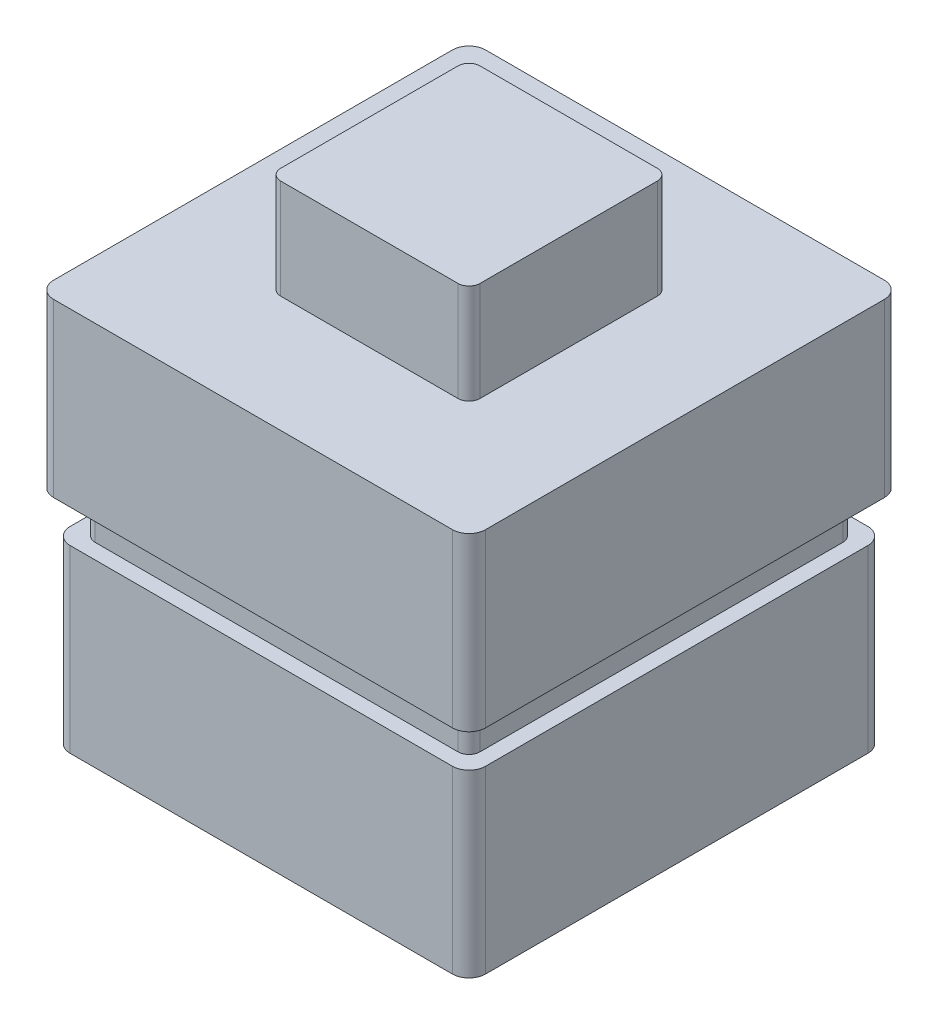
from build123d import *

# Parameters (mm, degrees)
UPPER_START = 67
UPPER_DEPTH = 6.2
NECK_START  = 65.5
NECK_DEPTH  = 1.7
BODY_START  = 59
BODY_DEPTH  = 6.5
STEM_START  = 73.2
STEM_DEPTH  = 3.6


with BuildPart() as part:
    # Sketch1 → Upper (new body)
    with BuildSketch(Plane(origin=(0, 0, 0), x_dir=(1, 0, 0), z_dir=(0, 1, 0)).offset(UPPER_START)):
        with BuildLine():
            Line((-7.2, 89.3), (7.2, 89.3))
            ThreePointArc((7.2, 89.3), (7.624264069, 89.124264069), (7.8, 88.7))
            Line((7.8, 88.7), (7.8, 74.3))
            ThreePointArc((7.8, 74.3), (7.624264069, 73.875735931), (7.2, 73.7))
            Line((7.2, 73.7), (-7.2, 73.7))
            ThreePointArc((-7.2, 73.7), (-7.624264069, 73.875735931), (-7.8, 74.3))
            Line((-7.8, 74.3), (-7.8, 88.7))
            ThreePointArc((-7.8, 88.7), (-7.624264069, 89.124264069), (-7.2, 89.3))
        make_face()
    extrude(amount=UPPER_DEPTH)

    # Sketch2 → Neck (add)
    with BuildSketch(Plane(origin=(0, 0, 0), x_dir=(1, 0, 0), z_dir=(0, 1, 0)).offset(NECK_START)):
        with BuildLine():
            Line((-6.55, 88.45), (6.55, 88.45))
            ThreePointArc((6.55, 88.45), (6.832842712, 88.332842712), (6.95, 88.05))
            Line((6.95, 88.05), (6.95, 74.95))
            ThreePointArc((6.95, 74.95), (6.832842712, 74.667157288), (6.55, 74.55))
            Line((6.55, 74.55), (-6.55, 74.55))
            ThreePointArc((-6.55, 74.55), (-6.832842712, 74.667157288), (-6.95, 74.95))
            Line((-6.95, 74.95), (-6.95, 88.05))
            ThreePointArc((-6.95, 88.05), (-6.832842712, 88.332842712), (-6.55, 88.45))
        make_face()
    extrude(amount=NECK_DEPTH)

    # Sketch3 → Body (add)
    with BuildSketch(Plane(origin=(0, 0, 0), x_dir=(1, 0, 0), z_dir=(0, 1, 0)).offset(BODY_START)):
        with BuildLine():
            Line((-6.9, 89), (6.9, 89))
            ThreePointArc((6.9, 89), (7.324264069, 88.824264069), (7.5, 88.4))
            Line((7.5, 88.4), (7.5, 74.6))
            ThreePointArc((7.5, 74.6), (7.324264069, 74.175735931), (6.9, 74))
            Line((6.9, 74), (-6.9, 74))
            ThreePointArc((-6.9, 74), (-7.324264069, 74.175735931), (-7.5, 74.6))
            Line((-7.5, 74.6), (-7.5, 88.4))
            ThreePointArc((-7.5, 88.4), (-7.324264069, 88.824264069), (-6.9, 89))
        make_face()
    extrude(amount=BODY_DEPTH)

    # Sketch4 → Stem (add)
    with BuildSketch(Plane(origin=(0, 0, 0), x_dir=(1, 0, 0), z_dir=(0, 1, 0)).offset(STEM_START)):
        with BuildLine():
            Line((-3.2, 85.1), (3.2, 85.1))
            ThreePointArc((3.2, 85.1), (3.482842712, 84.982842712), (3.6, 84.7))
            Line((3.6, 84.7), (3.6, 78.3))
            ThreePointArc((3.6, 78.3), (3.482842712, 78.017157288), (3.2, 77.9))
            Line((3.2, 77.9), (-3.2, 77.9))
            ThreePointArc((-3.2, 77.9), (-3.482842712, 78.017157288), (-3.6, 78.3))
            Line((-3.6, 78.3), (-3.6, 84.7))
            ThreePointArc((-3.6, 84.7), (-3.482842712, 84.982842712), (-3.2, 85.1))
        make_face()
    extrude(amount=STEM_DEPTH)


solid = part.part
